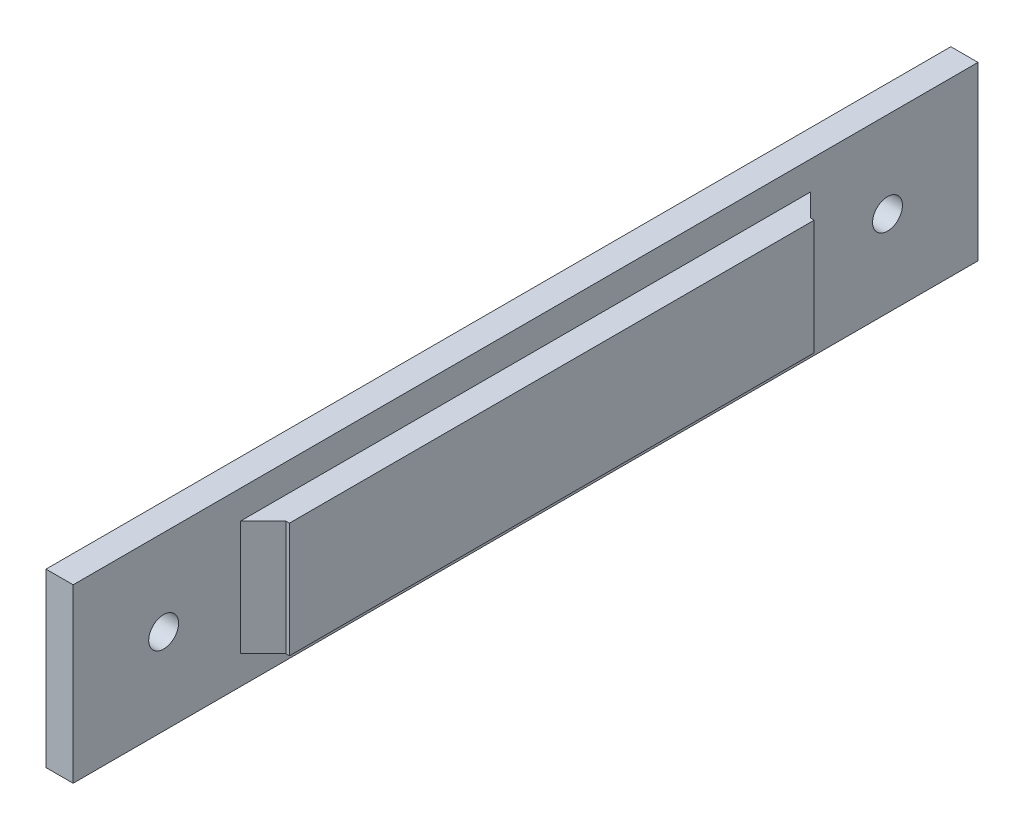
from build123d import *

# Parameters (mm, degrees)
SKETCH_1_W          = 19
SKETCH_1_H          = 19
SKETCH_1_W_2        = 13
SKETCH_1_H_2        = 13
EXTRUDE_1_DEPTH     = 100
SKETCH_2_R          = 1.65
CUT_EXTRUDE_1_DEPTH = 30
SKETCH_3_W          = 100
SKETCH_3_H          = 19
CUT_EXTRUDE_2_DEPTH = 16
SKETCH_4_W          = 58
SKETCH_4_H          = 12.7
EXTRUDE_1_2_DEPTH   = 2.9
CHAMFER_1_SIZE      = 2.5
CUT_EXTRUDE_3_DEPTH = 0.5


with BuildPart() as part:
    # 草图1 → Extrude 1 (new body)
    with BuildSketch(Plane.XY):
        with Locations((6.5, 6.5)):
            Rectangle(SKETCH_1_W, SKETCH_1_H)
        with Locations((6.5, 6.5)):
            Rectangle(SKETCH_1_W_2, SKETCH_1_H_2, mode=Mode.SUBTRACT)
    extrude(amount=EXTRUDE_1_DEPTH)

    # 草图2 → 切除-拉伸1 (cut)
    with BuildSketch(Plane.ZY.offset(3)):
        with Locations((10, 6.5)):
            Circle(SKETCH_2_R)
        with Locations((90, 6.5)):
            Circle(SKETCH_2_R)
    extrude(amount=-CUT_EXTRUDE_1_DEPTH, mode=Mode.SUBTRACT)

    # 草图3 → 切除-拉伸2 (cut)
    with BuildSketch(Plane(origin=(16, 0, 0), x_dir=(0, 0, -1), z_dir=(1, 0, 0))):
        with Locations((-50, 6.5)):
            Rectangle(SKETCH_3_W, SKETCH_3_H)
    extrude(amount=-CUT_EXTRUDE_2_DEPTH, mode=Mode.SUBTRACT)

    # 草图4 → Extrude 1 2 (add)
    with BuildSketch(Plane(origin=(0, 0, 0), x_dir=(0, 0, -1), z_dir=(1, 0, 0))):
        with Locations((-50, 6.5)):
            Rectangle(SKETCH_4_W, SKETCH_4_H)
    extrude(amount=EXTRUDE_1_2_DEPTH)

    # 倒角1
    chamfer_1_edges = [part.edges().sort_by_distance(p)[0] for p in [
        (0, 6.5, 79),
        (0, 6.5, 21),
    ]]
    chamfer(chamfer_1_edges, length=CHAMFER_1_SIZE)

    # 草图5 → 切除-拉伸3 (cut)
    with BuildSketch(Plane.ZY.offset(3)):
        with BuildLine():
            Line((30.586937728, 10.679888635), (30.621989933, 10.720161381))
            Line((30.621989933, 10.720161381), (30.84349004, 10.443472696))
            add(Edge.make_bspline(
                [(30.84349004, 10.443472696), (30.83708826, 10.431510635), (30.824443493, 10.407883222), (30.803545162, 10.371482679), (30.787162003, 10.325923979), (30.776564409, 10.268620691), (30.769071969, 10.200288967), (30.768476974, 10.151394892), (30.768165088, 10.125765473)],
                knots=[0, 0, 0, 0, 0.736410598, 1.454555069, 2.274010016, 3.348139226, 4.609940921, 6, 6, 6, 6], degree=3))
            Line((30.768165088, 10.125765473), (30.768165088, 7.55875077))
            add(Edge.make_bspline(
                [(30.768165088, 7.55875077), (30.788802635, 7.558530252), (30.826603902, 7.558126335), (30.877283355, 7.56056308), (30.916874663, 7.560345448), (30.949219431, 7.563042864), (30.983704226, 7.567659426), (31.028424628, 7.573585484), (31.088181575, 7.580830583), (31.157757342, 7.59079457), (31.228352397, 7.601285554), (31.290046684, 7.610728017), (31.338003127, 7.619153416), (31.383113979, 7.62695898), (31.427412813, 7.642331764), (31.466286481, 7.670689696), (31.491280007, 7.699459915), (31.510734748, 7.706783913), (31.51768565, 7.709400674)],
                knots=[0, 0, 0, 0, 1.271684107, 2.329311289, 3.126176351, 3.710204741, 4.32783396, 5.270448411, 6.49050515, 8.03759688, 9.602040843, 10.889228832, 11.884182716, 12.602334394, 13.712376462, 14.732953672, 15.547302315, 16, 16, 16, 16], degree=3))
            add(Edge.make_bspline(
                [(31.51768565, 7.709400674), (31.520935775, 7.706937549), (31.530376727, 7.699782671), (31.549243877, 7.683528107), (31.580524639, 7.657750421), (31.618454296, 7.620998948), (31.657385217, 7.584981429), (31.688352944, 7.556360351), (31.710595112, 7.535944428), (31.719207732, 7.514804436), (31.722800626, 7.497723029), (31.723834585, 7.487661956), (31.724269925, 7.483425818)],
                knots=[0, 0, 0, 0, 0.390394386, 1.134016561, 2.38360509, 4.269889804, 6.18981564, 7.453157385, 8.329021544, 9.032311711, 9.592562279, 10, 10, 10, 10], degree=3))
            add(Edge.make_bspline(
                [(31.724269925, 7.483425818), (31.72218826, 7.478629945), (31.718002952, 7.468987567), (31.703215387, 7.45963487), (31.684107082, 7.454667931), (31.65086428, 7.455228715), (31.603234972, 7.456802817), (31.541453719, 7.447216138), (31.475141459, 7.438018331), (31.422503531, 7.429787505), (31.382512016, 7.423979572), (31.353348028, 7.421407917), (31.316618835, 7.417285099), (31.272056682, 7.41398211), (31.219865672, 7.409352964), (31.159949504, 7.404178398), (31.092367359, 7.398028837), (31.044610406, 7.394365599), (31.019496859, 7.392439242)],
                knots=[0, 0, 0, 0, 0.341365878, 0.68633572, 1.116730632, 1.647491765, 2.890856209, 4.29325764, 5.800779701, 7.359923239, 7.845242571, 8.495183841, 9.311733456, 10.309872826, 11.474601469, 12.805924266, 14.320358265, 16, 16, 16, 16], degree=3))
            Line((31.019496859, 7.392439242), (30.808437834, 7.372302869))
            Line((30.808437834, 7.372302869), (30.692094344, 7.362607578))
            add(Edge.make_bspline(
                [(30.692094344, 7.362607578), (30.679983531, 7.358661489), (30.66035475, 7.352265805), (30.631408039, 7.356386108), (30.618842712, 7.373144256), (30.609107676, 7.391525507), (30.609842584, 7.420182697), (30.615237295, 7.459940839), (30.622213812, 7.514666312), (30.625430547, 7.556010193), (30.627210475, 7.578887143)],
                knots=[0, 0, 0, 0, 1.058270145, 1.715207142, 2.242218181, 2.723015089, 3.427046488, 4.550153686, 6.091084828, 8, 8, 8, 8], degree=3))
            Line((30.627210475, 7.578887143), (30.636905765, 7.875712202))
            Line((30.636905765, 7.875712202), (30.636905765, 10.141427096))
            add(Edge.make_bspline(
                [(30.636905765, 10.141427096), (30.637011364, 10.169519622), (30.637201073, 10.219988107), (30.636097576, 10.286853129), (30.635896613, 10.336597537), (30.633633183, 10.38108723), (30.630924782, 10.428341235), (30.626833582, 10.486935869), (30.617479956, 10.555218247), (30.604019587, 10.60297023), (30.596633019, 10.629174806)],
                knots=[0, 0, 0, 0, 1.372323329, 2.465391677, 3.267017655, 3.801925377, 4.641299591, 5.579257235, 6.671583216, 8, 8, 8, 8], degree=3))
            Line((30.596633019, 10.629174806), (30.586937728, 10.679888635))
        make_face()
        with BuildLine():
            add(Edge.make_bspline(
                [(32.690815844, 9.360583286), (32.701987478, 9.383710331), (32.723508171, 9.428261558), (32.75489812, 9.492614501), (32.784182081, 9.551698577), (32.809228705, 9.606525035), (32.832583543, 9.655885139), (32.853384051, 9.700307306), (32.871357091, 9.739806059), (32.890278906, 9.783658133), (32.909903718, 9.829406022), (32.928902185, 9.87421491), (32.942718093, 9.906222932), (32.949860946, 9.923155848), (32.952588697, 9.929622281)],
                knots=[0, 0, 0, 0, 1.475873638, 2.843077615, 4.114458223, 5.26483622, 6.306479236, 7.252326145, 8.083448402, 8.799989154, 9.996708352, 10.943956596, 11.596712522, 12, 12, 12, 12], degree=3))
            Line((32.952588697, 9.929622281), (33.113679684, 10.357706662))
            add(Edge.make_bspline(
                [(33.113679684, 10.357706662), (33.078643527, 10.354277971), (33.002196361, 10.346796736), (32.904636304, 10.340856621), (32.823518612, 10.3365308), (32.767858007, 10.331866678), (32.719118199, 10.327507255), (32.689071208, 10.324190631), (32.675154221, 10.322654456)],
                knots=[0, 0, 0, 0, 1.440114021, 3.142257811, 3.998086789, 4.76330671, 5.427195687, 6, 6, 6, 6], degree=3))
            Line((32.675154221, 10.322654456), (32.524504316, 10.297297542))
            add(Edge.make_bspline(
                [(32.524504316, 10.297297542), (32.517772871, 10.295882366), (32.499407651, 10.292021381), (32.465444687, 10.281478225), (32.416531747, 10.268512576), (32.379302331, 10.257850043), (32.358192789, 10.251804254)],
                knots=[0, 0, 0, 0, 0.478461291, 1.305373098, 2.472113022, 4, 4, 4, 4], degree=3))
            Line((32.358192789, 10.251804254), (32.308224751, 10.23166788))
            Line((32.308224751, 10.23166788), (32.18218597, 10.418115782))
            add(Edge.make_bspline(
                [(32.18218597, 10.418115782), (32.176863772, 10.42541561), (32.167778213, 10.437877196), (32.16023558, 10.455212517), (32.154636782, 10.467255782), (32.159654818, 10.479383366), (32.179497607, 10.477564814), (32.194479213, 10.466928115), (32.213614914, 10.456694245), (32.235630965, 10.455254915), (32.262322216, 10.453688504), (32.281884564, 10.456728872), (32.292563127, 10.458388528)],
                knots=[0, 0, 0, 0, 1.323589942, 2.259509366, 2.829398404, 3.190947808, 3.965341466, 5.19662492, 6.050472624, 7.088782, 8.410843841, 10, 10, 10, 10], degree=3))
            Line((32.292563127, 10.458388528), (32.453654114, 10.463609069))
            Line((32.453654114, 10.463609069), (33.088322769, 10.538934021))
            Line((33.088322769, 10.538934021), (33.138290807, 10.584427309))
            Line((33.138290807, 10.584427309), (33.178563554, 10.624700056))
            add(Edge.make_bspline(
                [(33.178563554, 10.624700056), (33.17981253, 10.623213323), (33.184932638, 10.617118544), (33.195955315, 10.602615714), (33.215555177, 10.579314974), (33.230373545, 10.559897381), (33.238972674, 10.548629312)],
                knots=[0, 0, 0, 0, 0.23984028, 0.983211964, 2.249351781, 4, 4, 4, 4], degree=3))
            Line((33.238972674, 10.548629312), (33.335179791, 10.427811072))
            add(Edge.make_bspline(
                [(33.335179791, 10.427811072), (33.34164025, 10.41942303), (33.352376511, 10.405483433), (33.360341537, 10.383190004), (33.352179822, 10.368085692), (33.340778398, 10.355138556), (33.32229663, 10.339588054), (33.307653427, 10.328767025), (33.299381794, 10.322654456)],
                knots=[0, 0, 0, 0, 1.419029252, 2.358201718, 2.827787952, 3.596253847, 4.642174893, 6, 6, 6, 6], degree=3))
            Line((33.299381794, 10.322654456), (33.244193215, 10.277161168))
            add(Edge.make_bspline(
                [(33.244193215, 10.277161168), (33.22806468, 10.236627871), (33.197463051, 10.159721629), (33.153372166, 10.050270763), (33.113027205, 9.952953209), (33.077601534, 9.866919056), (33.045062556, 9.793146164), (33.018199708, 9.730548061), (32.994014401, 9.680326686), (32.979221401, 9.650928115), (32.972725071, 9.638017763)],
                knots=[0, 0, 0, 0, 1.507300768, 2.859891598, 4.076963614, 5.147345159, 6.074452096, 6.862861548, 7.500626815, 8, 8, 8, 8], degree=3))
            Line((32.972725071, 9.638017763), (32.821329375, 9.350887995))
            add(Edge.make_bspline(
                [(32.821329375, 9.350887995), (32.839224833, 9.352316842), (32.873497794, 9.355053334), (32.925802563, 9.360277165), (32.982791617, 9.353091832), (33.032775945, 9.333101224), (33.075303885, 9.308434346), (33.109381531, 9.283796983), (33.141937582, 9.251775306), (33.175134746, 9.214131485), (33.208409459, 9.169201631), (33.238997392, 9.114782353), (33.270839039, 9.052640403), (33.310660687, 8.957937068), (33.353689673, 8.831222073), (33.379833386, 8.672067332), (33.392750382, 8.512610649), (33.394646689, 8.406491965), (33.395588911, 8.35376462)],
                knots=[0, 0, 0, 0, 0.660541429, 1.265053373, 1.928435853, 2.750244091, 3.225390118, 3.735570922, 4.291687282, 4.900607759, 5.580848831, 6.342918567, 7.193367346, 8.147740655, 10.119512469, 12.097611575, 14.061014616, 16, 16, 16, 16], degree=3))
            add(Edge.make_bspline(
                [(33.395588911, 8.35376462), (33.393598548, 8.312484741), (33.389817499, 8.234066224), (33.380679599, 8.123254843), (33.367043187, 8.026038916), (33.347184085, 7.916436388), (33.312161105, 7.795347164), (33.268894658, 7.683631171), (33.227813818, 7.603146156), (33.193191804, 7.549777038), (33.155270821, 7.502031542), (33.114519779, 7.460249058), (33.072130288, 7.425912623), (33.03098935, 7.396382164), (32.989358896, 7.375510996), (32.935464546, 7.358075198), (32.869604362, 7.346056595), (32.817149559, 7.343648721), (32.791497711, 7.342471204)],
                knots=[0, 0, 0, 0, 1.512752116, 2.8737433, 4.067977017, 5.104892351, 6.948544146, 8.672095895, 9.482011449, 10.251829035, 10.996496654, 11.710742831, 12.38300564, 12.991319199, 13.561044299, 14.079002633, 15.060579187, 16, 16, 16, 16], degree=3))
            add(Edge.make_bspline(
                [(32.791497711, 7.342471204), (32.769617776, 7.342098251), (32.727523291, 7.341380732), (32.666466344, 7.346351233), (32.61085689, 7.357727802), (32.558704457, 7.373203881), (32.509862014, 7.397677509), (32.463208033, 7.432637995), (32.416242434, 7.475687811), (32.371211824, 7.528517801), (32.329999196, 7.589043474), (32.293963959, 7.655993138), (32.26402364, 7.72841898), (32.234259184, 7.831490913), (32.209031285, 7.963289589), (32.204536867, 8.069993347), (32.202322343, 8.122569223)],
                knots=[0, 0, 0, 0, 0.828828519, 1.594571005, 2.314948186, 2.97625877, 3.650192192, 4.371738268, 5.178272596, 6.059897072, 6.995131469, 7.947518938, 8.935744196, 9.957858231, 12.008325587, 14, 14, 14, 14], degree=3))
            Line((32.202322343, 8.122569223), (32.197101802, 8.318712415))
            Line((32.197101802, 8.318712415), (32.252290381, 8.318712415))
            add(Edge.make_bspline(
                [(32.252290381, 8.318712415), (32.256510578, 8.28962594), (32.264592631, 8.233922761), (32.276348905, 8.15355723), (32.288525218, 8.080298604), (32.302247581, 7.993604017), (32.325101737, 7.896255346), (32.363604023, 7.791482764), (32.415818514, 7.702956542), (32.477124756, 7.630004861), (32.54882606, 7.577052768), (32.625583492, 7.543651687), (32.70381317, 7.527881131), (32.755645396, 7.528077193), (32.781056628, 7.528173314)],
                knots=[0, 0, 0, 0, 0.994021113, 1.903638599, 2.746793397, 3.505624798, 4.871908371, 6.122639036, 7.264652637, 8.331625701, 9.323760524, 10.250011688, 11.142051883, 12, 12, 12, 12], degree=3))
            add(Edge.make_bspline(
                [(32.781056628, 7.528173314), (32.801499584, 7.529936164), (32.841538828, 7.533388853), (32.899600078, 7.546533606), (32.953295055, 7.568962603), (33.003489188, 7.597644405), (33.048668914, 7.635046463), (33.089330911, 7.6791183), (33.123766421, 7.731474586), (33.162358929, 7.811629034), (33.199864922, 7.922132529), (33.228085203, 8.062491308), (33.246448603, 8.205660988), (33.255075627, 8.348114118), (33.256251105, 8.488455185), (33.244711217, 8.580304044), (33.238972674, 8.625978556)],
                knots=[0, 0, 0, 0, 0.647840119, 1.268849254, 1.871153999, 2.479976942, 3.088343857, 3.716462885, 4.367721208, 5.059616847, 6.52246665, 8.039623249, 9.575767262, 11.078710543, 12.547304005, 14, 14, 14, 14], degree=3))
            add(Edge.make_bspline(
                [(33.238972674, 8.625978556), (33.230948492, 8.675208948), (33.215086531, 8.772526103), (33.178394755, 8.889335206), (33.142263588, 8.976559279), (33.110028315, 9.03507969), (33.073491039, 9.087352263), (33.032103604, 9.131194042), (32.990148353, 9.167171052), (32.94803647, 9.191177614), (32.906448766, 9.203530873), (32.879800313, 9.200814943), (32.866822663, 9.1994923)],
                knots=[0, 0, 0, 0, 2.019199264, 3.991492233, 4.943861116, 5.841091039, 6.693606335, 7.520378909, 8.278781735, 8.923571305, 9.475785111, 10, 10, 10, 10], degree=3))
            Line((32.866822663, 9.1994923), (32.78627717, 9.189797009))
            Line((32.78627717, 9.189797009), (32.751224964, 9.124167348))
            add(Edge.make_bspline(
                [(32.751224964, 9.124167348), (32.746546439, 9.115988257), (32.73839062, 9.101730095), (32.727245782, 9.082884017), (32.718344539, 9.071845434), (32.711588293, 9.062329366), (32.701821577, 9.065530584), (32.695539609, 9.076469554), (32.685497304, 9.092573251), (32.678964877, 9.106403976), (32.675154221, 9.114472057)],
                knots=[0, 0, 0, 0, 1.659028505, 2.892093886, 3.763458346, 4.288089223, 4.647361994, 5.327919393, 6.441255868, 8, 8, 8, 8], degree=3))
            Line((32.675154221, 9.114472057), (32.594608727, 9.270342502))
            add(Edge.make_bspline(
                [(32.594608727, 9.270342502), (32.588786742, 9.279300929), (32.578637363, 9.294918022), (32.583037394, 9.312720213), (32.584913436, 9.32031054)],
                knots=[0, 0, 0, 0, 1.147259222, 2, 2, 2, 2], degree=3))
            Line((32.584913436, 9.32031054), (32.625186183, 9.335972163))
            Line((32.625186183, 9.335972163), (32.690815844, 9.360583286))
        make_face()
    extrude(amount=-CUT_EXTRUDE_3_DEPTH, mode=Mode.SUBTRACT)


solid = part.part
